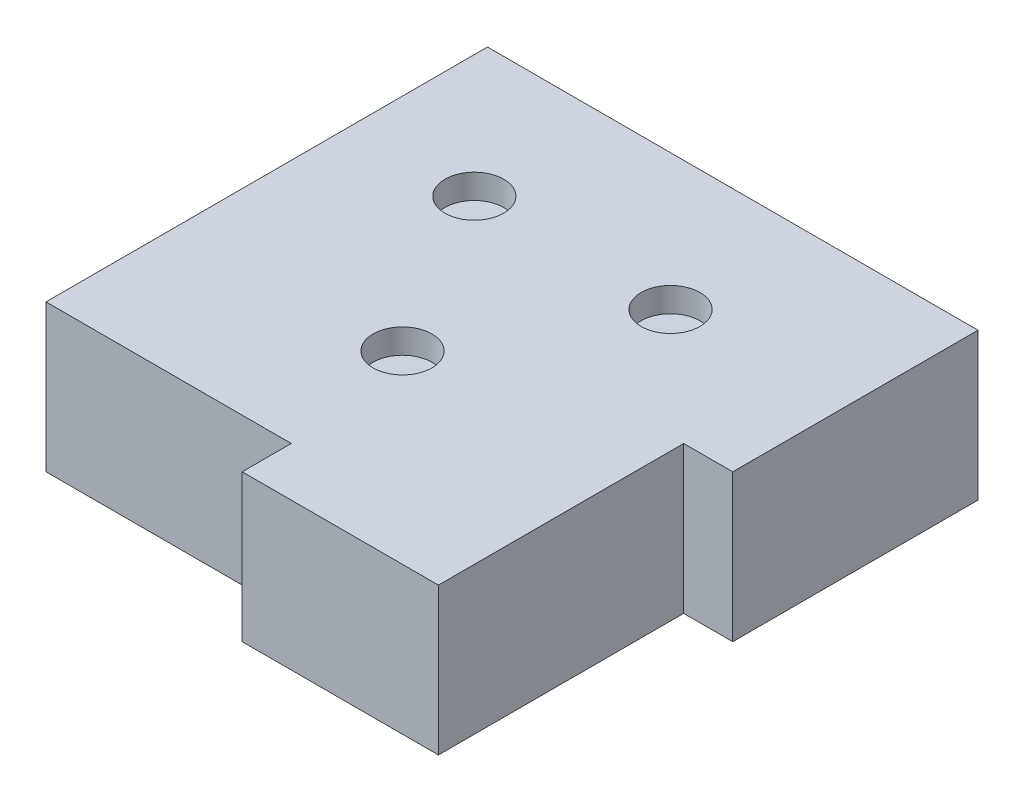
from build123d import *

# Parameters (mm, degrees)
BOSS_EXTRUDE2_DEPTH = 30
SKETCH3_R           = 6
CUT_EXTRUDE1_DEPTH  = 5


with BuildPart() as part:
    # Sketch1 → Boss-Extrude2 (new body)
    with BuildSketch(Plane(origin=(0, 0, 0), x_dir=(1, 0, 0), z_dir=(0, 1, 0))):
        Polygon((0, 10), (50, 10), (50, 0), (90, 0), (90, 50), (100, 50), (100, 100), (0, 100), align=None)
    extrude(amount=BOSS_EXTRUDE2_DEPTH)

    # Sketch3 → Cut-Extrude1 (cut)
    with BuildSketch(Plane(origin=(0, 30, 0), x_dir=(1, 0, 0), z_dir=(0, 1, 0))):
        with Locations(Location((25, 72.32, 0), (0, 0, 270))):
            Circle(SKETCH3_R)
        with Locations(Location((65, 72.32, 0), (0, 0, 270))):
            Circle(SKETCH3_R)
        with Locations(Location((45, 37.68, 0), (0, 0, 270))):
            Circle(SKETCH3_R)
    extrude(amount=-CUT_EXTRUDE1_DEPTH, mode=Mode.SUBTRACT)


solid = part.part
